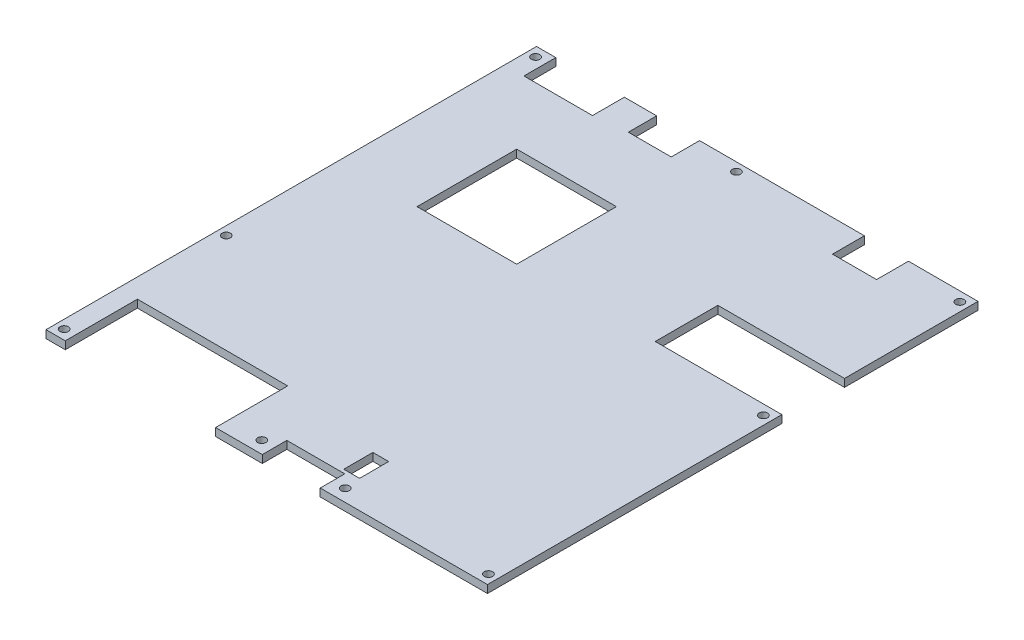
from build123d import *

# Parameters (mm, degrees)
SKETCH1_R           = 1.7
SKETCH1_W           = 40.64
SKETCH1_H           = 40.64
SKETCH1_W_2         = 6.441435375
SKETCH1_H_2         = 11.864636979
BOSS_EXTRUDE1_DEPTH = 3.175


with BuildPart() as part:
    # Sketch1 → Boss-Extrude1 (new body)
    with BuildSketch(Plane(origin=(0, 0, 0), x_dir=(1, 0, 0), z_dir=(0, 1, 0))):
        Polygon((-89.999999959, 100.000000025), (-82.146123441, 100.000000025), (-82.146123441, 87.012397876), (-54.188171851, 87.012397876), (-54.188171851, 100.000000025), (-41.018658576, 100.000000025), (-41.018658576, 88.447791729), (-23.524827511, 88.447791729), (-23.524827511, 100.000000025), (43.67960641, 100.000000025), (43.67960641, 87.012397876), (61.636212859, 87.012397876), (61.636212859, 100.000000025), (89.999999959, 100.000000025), (89.999999959, 45.570881719), (38.364340903, 45.570881719), (38.364340903, 20.032473827), (89.999999959, 20.032473827), (89.999999959, -100.000000025), (21.816000041, -100.000000025), (21.816000041, -90.000000025), (-1.805999959, -90.000000025), (-1.805999959, -100.000000025), (-20.869596106, -100.000000025), (-20.869596106, -70.58952404), (-82.146123441, -70.58952404), (-82.146123441, -100.000000025), (-89.999999959, -100.000000025), align=None)
        with Locations(Location((-86.499999959, 96.111111133, 0), (0, 0, 270))):
            Circle(SKETCH1_R, mode=Mode.SUBTRACT)
        with Locations(Location((-4.999999959, 96.500000025, 0), (0, 0, 270))):
            Circle(SKETCH1_R, mode=Mode.SUBTRACT)
        with Locations(Location((86.500000041, 96.111111224, 0), (0, 0, 270))):
            Circle(SKETCH1_R, mode=Mode.SUBTRACT)
        with Locations(Location((-86.499999959, -96.111111133, 0), (0, 0, 270))):
            Circle(SKETCH1_R, mode=Mode.SUBTRACT)
        with Locations(Location((-6.989999959, -95.000000025, 0), (0, 0, 270))):
            Circle(SKETCH1_R, mode=Mode.SUBTRACT)
        with Locations(Location((27.000000041, -95.000000025, 0), (0, 0, 270))):
            Circle(SKETCH1_R, mode=Mode.SUBTRACT)
        with Locations(Location((86.500000041, -96.111111224, 0), (0, 0, 270))):
            Circle(SKETCH1_R, mode=Mode.SUBTRACT)
        with Locations(Location((86.499999959, 15.999999975, 0), (0, 0, 270))):
            Circle(SKETCH1_R, mode=Mode.SUBTRACT)
        with Locations(Location((-86.499999959, -30.000000025, 0), (0, 0, 270))):
            Circle(SKETCH1_R, mode=Mode.SUBTRACT)
        with Locations((-37.475629524, 39.402171336)):
            Rectangle(SKETCH1_W, SKETCH1_H, mode=Mode.SUBTRACT)
        with Locations((23.20161852, -82.635134039)):
            Rectangle(SKETCH1_W_2, SKETCH1_H_2, mode=Mode.SUBTRACT)
    extrude(amount=BOSS_EXTRUDE1_DEPTH)


solid = part.part
